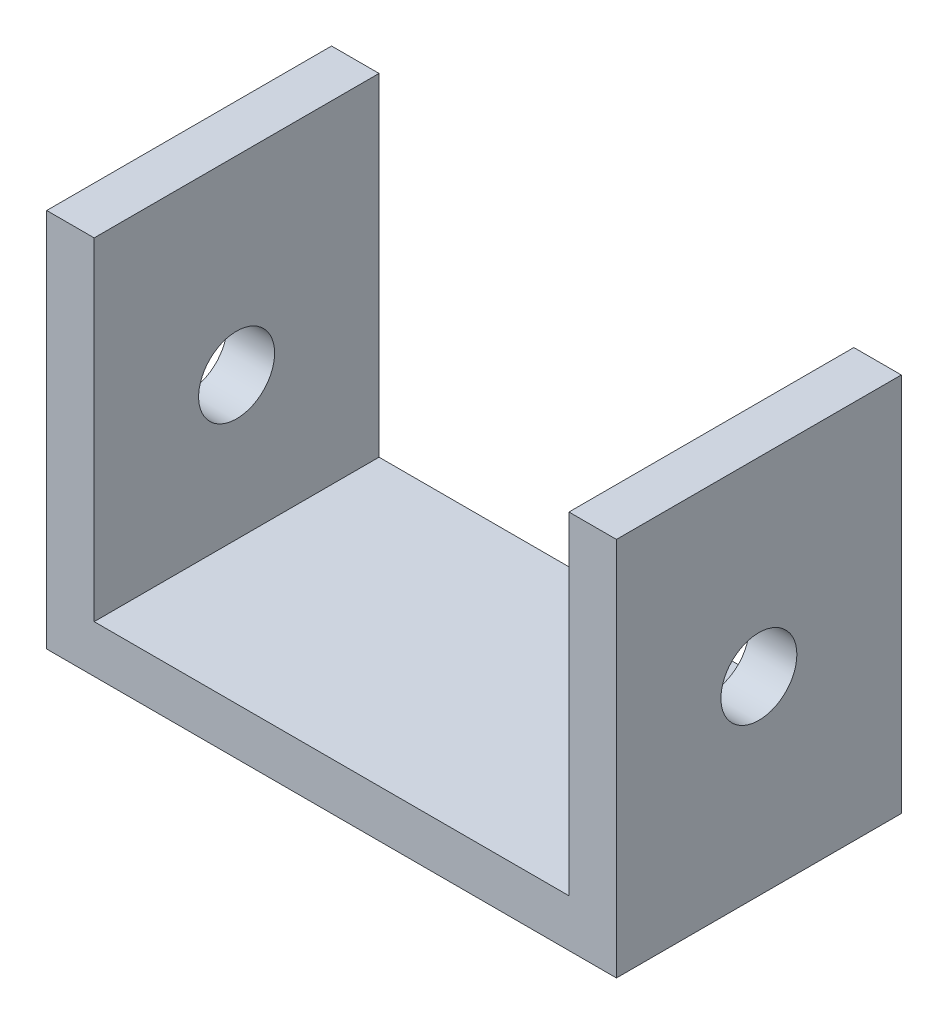
from build123d import *

# Parameters (mm, degrees)
SKETCH2_W        = 120
SKETCH2_H        = 60
BASE_DEPTH       = 10
SKETCH5_W        = 10
SKETCH5_H        = 60
UPRIGHT_DEPTH    = 70
SKETCH6_R        = 8
SHAFT_HOLE_DEPTH = 50


with BuildPart() as part:
    # Sketch2 → Base (new body)
    with BuildSketch(Plane(origin=(0, 0, 0), x_dir=(1, 0, 0), z_dir=(0, 1, 0))):
        Rectangle(SKETCH2_W, SKETCH2_H)
    extrude(amount=BASE_DEPTH)

    # Sketch5 → Upright (add)
    with BuildSketch(Plane(origin=(0, 10, 0), x_dir=(1, 0, 0), z_dir=(0, 1, 0))):
        with Locations((55, 0)):
            Rectangle(SKETCH5_W, SKETCH5_H)
    extrude(amount=UPRIGHT_DEPTH)

    # Sketch6 → Shaft Hole (cut)
    with BuildSketch(Plane(origin=(60, 0, 0), x_dir=(0, 0, -1), z_dir=(1, 0, 0))):
        with Locations((0, 40)):
            Circle(SKETCH6_R)
    extrude(amount=-SHAFT_HOLE_DEPTH, mode=Mode.SUBTRACT)

    # Mirror 2: part across plane


with BuildPart() as part_1:
    add(part.part)
    add(part.part.mirror(Plane(origin=(0, 0, 0), x_dir=(0, 0, 1), z_dir=(1, 0, 0))))


solid = part_1.part
